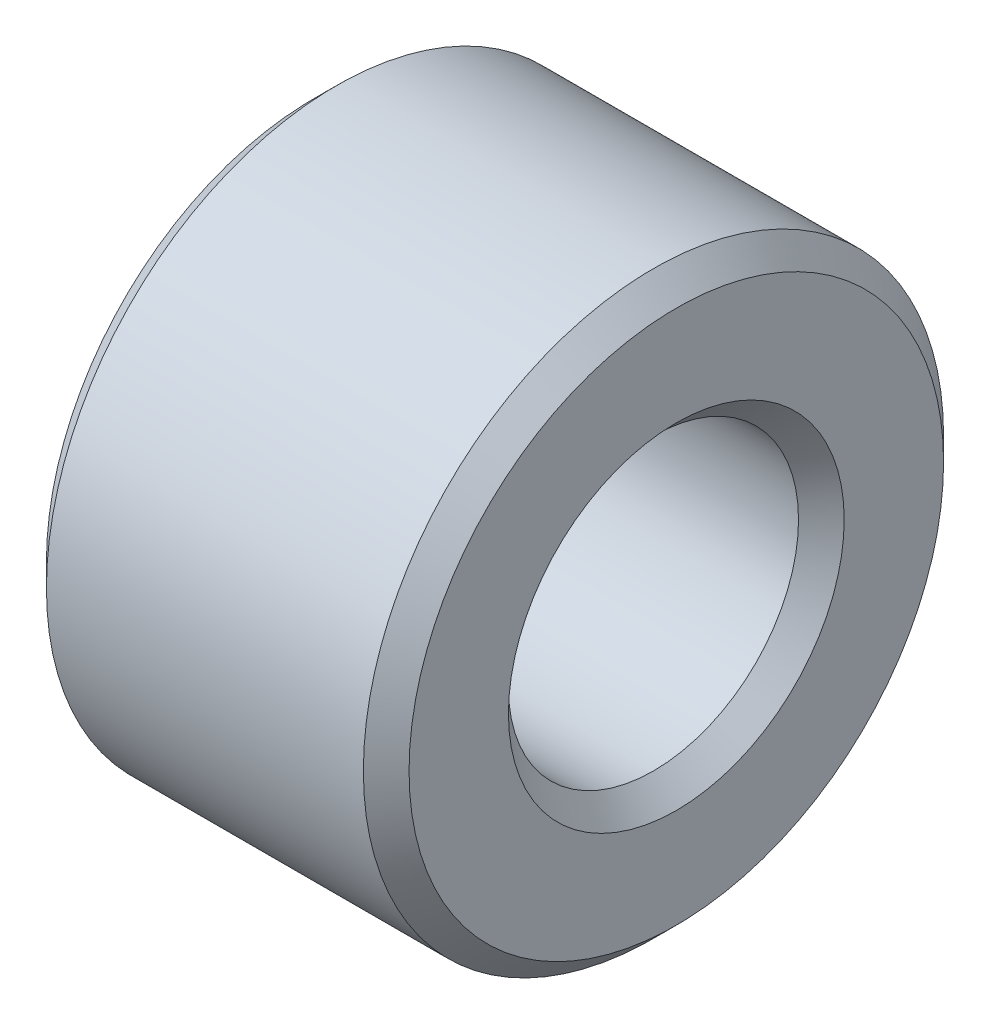
from build123d import *

# Parameters (mm, degrees)
SKETCH1_R           = 25.4
SKETCH1_R_2         = 12.7
BOSS_EXTRUDE1_DEPTH = 31.75
CHAMFER1_SIZE       = 2


with BuildPart() as part:
    # Sketch1 → Boss-Extrude1 (new body)
    with BuildSketch(Plane(origin=(0, 0, 0), x_dir=(0, 0, -1), z_dir=(1, 0, 0))):
        Circle(SKETCH1_R)
        Circle(SKETCH1_R_2, mode=Mode.SUBTRACT)
    extrude(amount=BOSS_EXTRUDE1_DEPTH)

    # Chamfer1
    chamfer1_edges = [part.edges().sort_by_distance(p)[0] for p in [
        (0, 0, 25.4),
        (31.75, 0, 25.4),
        (0, 0, 12.7),
        (31.75, 0, 12.7),
    ]]
    chamfer(chamfer1_edges, length=CHAMFER1_SIZE)


solid = part.part
